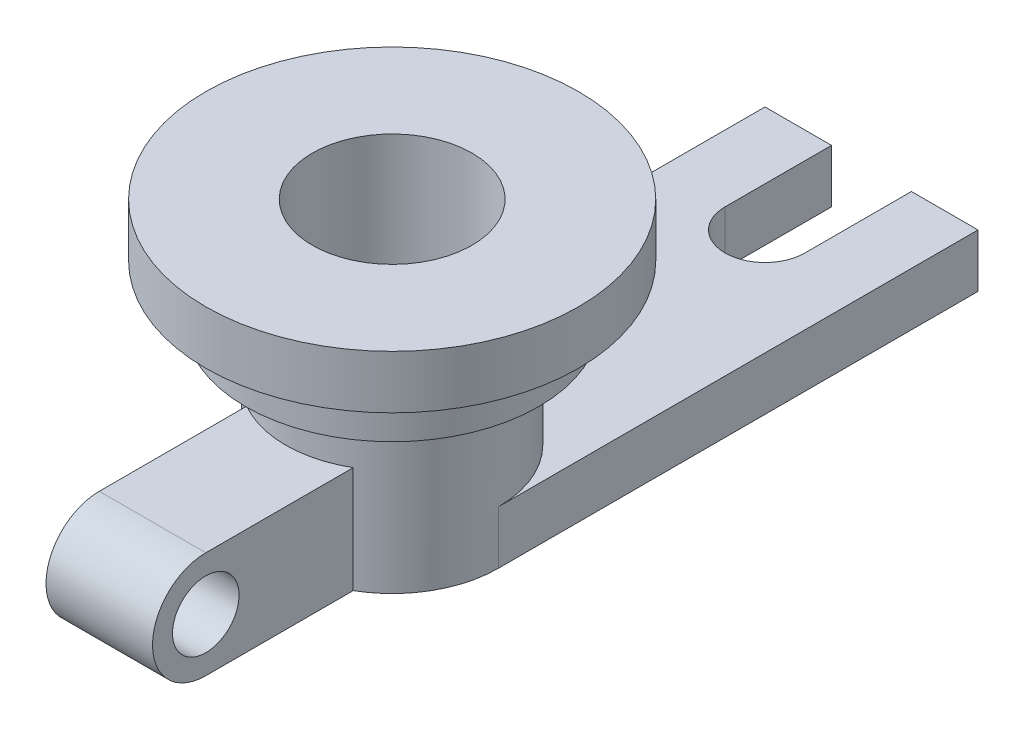
from build123d import *

# Parameters (mm, degrees)
BOSS_EXTRUDE1_DEPTH = 20
SKETCH3_R           = 12.5
BOSS_EXTRUDE2_DEPTH = 20


with BuildPart() as part:
    # Sketch2 → Revolve1 (revolve)
    with BuildSketch(Plane.XY, mode=Mode.PRIVATE) as revolve1_sk:
        Polygon((-30, 0), (-30, 100), (-70, 100), (-70, 80), (-55, 80), (-55, 60), (-40, 60), (-40, 0), align=None)
    revolve(revolve1_sk.sketch.rotate(Axis((0, 0, 0), (0, 1, 0)), 270), axis=Axis((0, 0, 0), (0, 1, 0)))

    # Sketch4 → Boss-Extrude1 (add)
    with BuildSketch(Plane(origin=(0, 0, 0), x_dir=(1, 0, 0), z_dir=(0, 1, 0))):
        with BuildLine():
            Line((-15, 140), (-15, 180))
            Line((-15, 180), (-40, 180))
            Line((-40, 180), (-40, 0))
            ThreePointArc((-40, 0), (0, 40), (40, 0))
            Line((40, 0), (40, 180))
            Line((40, 180), (15, 180))
            Line((15, 180), (15, 140))
            ThreePointArc((15, 140), (0, 125), (-15, 140))
        make_face()
    extrude(amount=BOSS_EXTRUDE1_DEPTH)

    # Sketch3 → Boss-Extrude2 (add, symmetric)
    with BuildSketch(Plane.ZY):
        with BuildLine():
            Line((30, 0), (30, 40))
            Line((30, 40), (90, 40))
            ThreePointArc((90, 40), (110, 20), (90, 0))
            Line((90, 0), (30, 0))
        make_face()
        with Locations((90, 20)):
            Circle(SKETCH3_R, mode=Mode.SUBTRACT)
    extrude(amount=BOSS_EXTRUDE2_DEPTH, both=True)


solid = part.part
